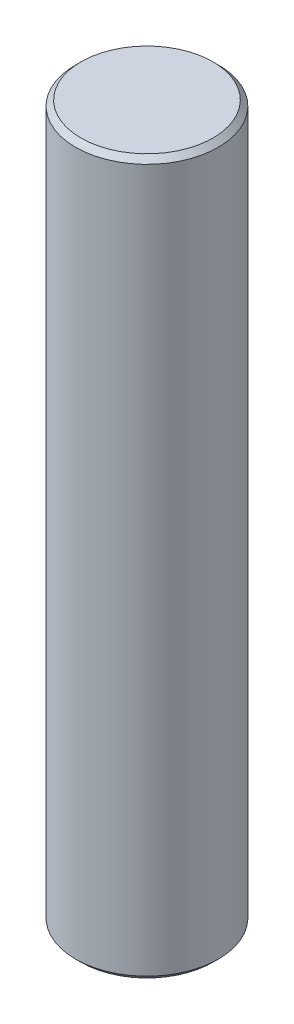
from build123d import *

# Parameters (mm, degrees)
SKETCH1_R           = 2
BOSS_EXTRUDE1_DEPTH = 20
CHAMFER1_SIZE       = 0.15


with BuildPart() as part:
    # Sketch1 → Boss-Extrude1 (new body)
    with BuildSketch(Plane(origin=(0, 0, 0), x_dir=(1, 0, 0), z_dir=(0, 1, 0))):
        with Locations(Location((0, 0, 0), (0, 0, 270))):
            Circle(SKETCH1_R)
    extrude(amount=BOSS_EXTRUDE1_DEPTH)

    # Chamfer1
    chamfer1_edges = [part.edges().sort_by_distance(p)[0] for p in [
        (0, 0, -2),
        (0, 20, -2),
    ]]
    chamfer(chamfer1_edges, length=CHAMFER1_SIZE)


solid = part.part
